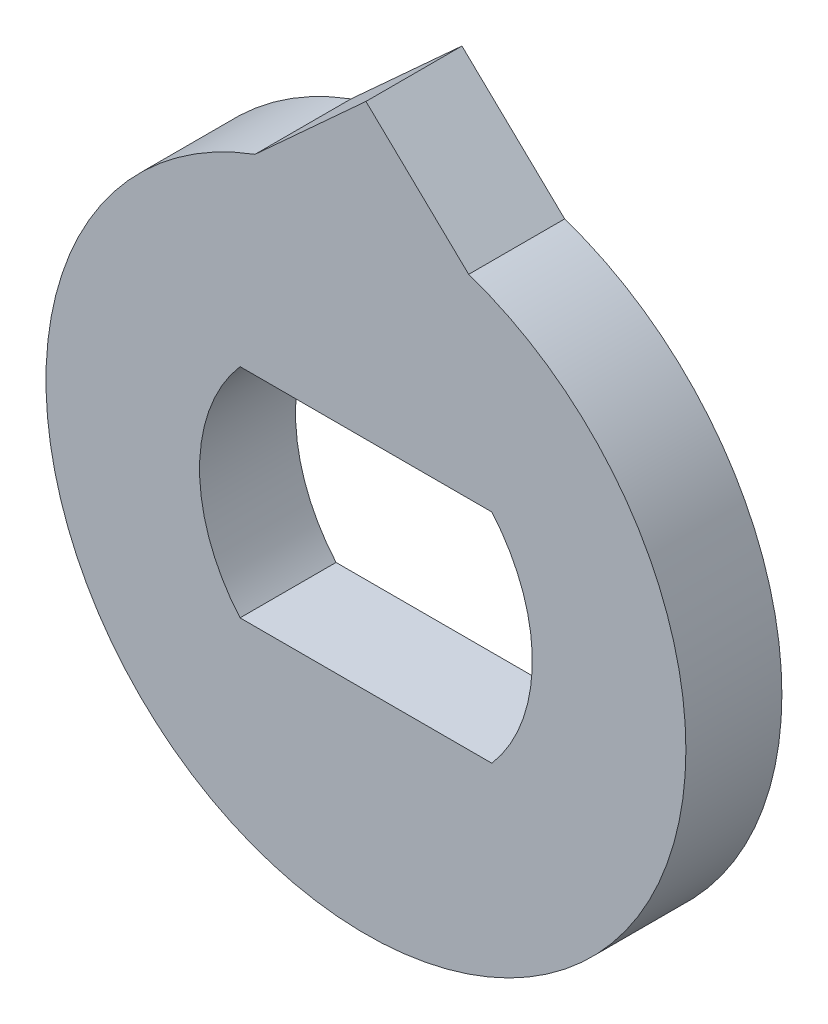
from build123d import *
from build123d.topology import SkipClean

# Parameters (mm, degrees)
SKETCH1_R           = 5
SKETCH1_R_2         = 2.6
BOSS_EXTRUDE1_DEPTH = 1.5


with BuildPart() as part:
    # Sketch1 → Boss-Extrude1 (new body)
    # profile 1 of 6: a face of its own
    with SkipClean():  # the faces are left unmerged after this step: merging them gives an invalid solid
        with BuildSketch(Plane.XY):
            Circle(SKETCH1_R)
            Circle(SKETCH1_R_2, mode=Mode.SUBTRACT)
        # profile 2 of 6: a face of its own
        with BuildSketch(Plane.XY):
            with BuildLine():
                Line((-1.967231557, 1.7), (-3.027185929, 1.7))
                Line((-3.027185929, 1.7), (-3.027185929, -1.7))
                Line((-3.027185929, -1.7), (-1.967231557, -1.7))
                ThreePointArc((-1.967231557, -1.7), (-2.6, 0), (-1.967231557, 1.7))
            make_face()
        # profile 3 of 6: a face of its own
        with BuildSketch(Plane.XY):
            with BuildLine():
                ThreePointArc((1.967231557, 1.7), (0, 2.6), (-1.967231557, 1.7))
                Line((-1.967231557, 1.7), (1.967231557, 1.7))
            make_face()
        # profile 4 of 6: a face of its own
        with BuildSketch(Plane.XY):
            with BuildLine():
                Line((3.027185929, 1.7), (1.967231557, 1.7))
                ThreePointArc((1.967231557, 1.7), (2.436678277, 0.906972423), (2.6, 0))
                ThreePointArc((2.6, 0), (2.436678277, -0.906972423), (1.967231557, -1.7))
                Line((1.967231557, -1.7), (3.027185929, -1.7))
                Line((3.027185929, -1.7), (3.027185929, 1.7))
            make_face()
        # profile 5 of 6: a face of its own
        with BuildSketch(Plane.XY):
            with BuildLine():
                Line((1.967231557, -1.7), (-1.967231557, -1.7))
                ThreePointArc((-1.967231557, -1.7), (0, -2.6), (1.967231557, -1.7))
            make_face()
        # profile 6 of 6: a face of its own
        with BuildSketch(Plane.XY):
            with BuildLine():
                Line((0, 6.272587449), (-1.733646509, 4.6898262))
                ThreePointArc((-1.733646509, 4.6898262), (-0.067970608, 4.999537978), (1.6055094, 4.735223286))
                Line((1.6055094, 4.735223286), (0, 6.272587449))
            make_face()
        extrude(amount=BOSS_EXTRUDE1_DEPTH)


solid = part.part
